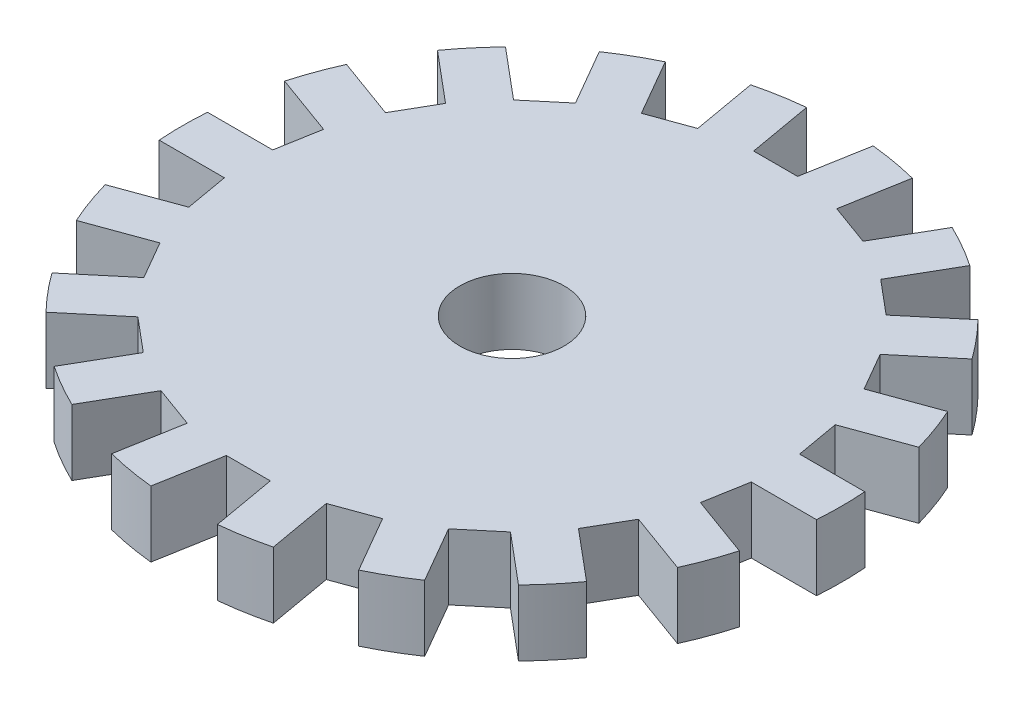
from build123d import *

# Parameters (mm, degrees)
SKETCH_1_R               = 15
EXTRUDE_1_DEPTH          = 3
CUT_EXTRUDE_START        = -3
CUT_EXTRUDE_1_DEPTH      = 3
PATTERN_CIRCULAR_1_COUNT = 18
SKETCH_3_R               = 2.375
CUT_EXTRUDE_2_DEPTH      = 10


with BuildPart() as part:
    # Эскиз1 → Бобышка-Вытянуть1 (new body)
    with BuildSketch(Plane(origin=(0, 0, 0), x_dir=(1, 0, 0), z_dir=(0, 1, 0))):
        with Locations(Location((0, 0, 0), (0, 0, 270))):
            Circle(SKETCH_1_R)
    extrude(amount=EXTRUDE_1_DEPTH)

    # Эскиз2 → Вырез-Вытянуть1 (cut)
    with BuildSketch(Plane(origin=(0, 3, 0), x_dir=(1, 0, 0), z_dir=(0, 1, 0)).offset(CUT_EXTRUDE_START)):
        with BuildLine():
            ThreePointArc((1.515448005, 14.923250897), (0.75869511, 14.980800437), (0, 15))
            Line((0, 15), (0, 12))
            Line((0, 12), (1, 12))
            Line((1, 12), (1.515448005, 14.923250897))
        make_face()
        with BuildLine():
            Line((0, 12), (0, 15))
            ThreePointArc((0, 15), (-0.75869511, 14.980800437), (-1.515448005, 14.923250897))
            Line((-1.515448005, 14.923250897), (-1, 12))
            Line((-1, 12), (0, 12))
        make_face()
    cut_extrude_1 = extrude(amount=CUT_EXTRUDE_1_DEPTH, mode=Mode.SUBTRACT)

    # Круговой массив1: Вырез-Вытянуть1 ×18 about axis
    pattern_circular_1_axis = Axis((0, 0, 0), (0, 1, 0))
    for i in range(1, PATTERN_CIRCULAR_1_COUNT):
        add(cut_extrude_1.rotate(pattern_circular_1_axis, i * 360 / PATTERN_CIRCULAR_1_COUNT), mode=Mode.SUBTRACT)

    # Эскиз3 → Вырез-Вытянуть2 (cut)
    with BuildSketch(Plane(origin=(0, 3, 0), x_dir=(1, 0, 0), z_dir=(0, 1, 0))):
        with Locations(Location((0, 0, 0), (0, 0, 270))):
            Circle(SKETCH_3_R)
    extrude(amount=-CUT_EXTRUDE_2_DEPTH, mode=Mode.SUBTRACT)


solid = part.part
